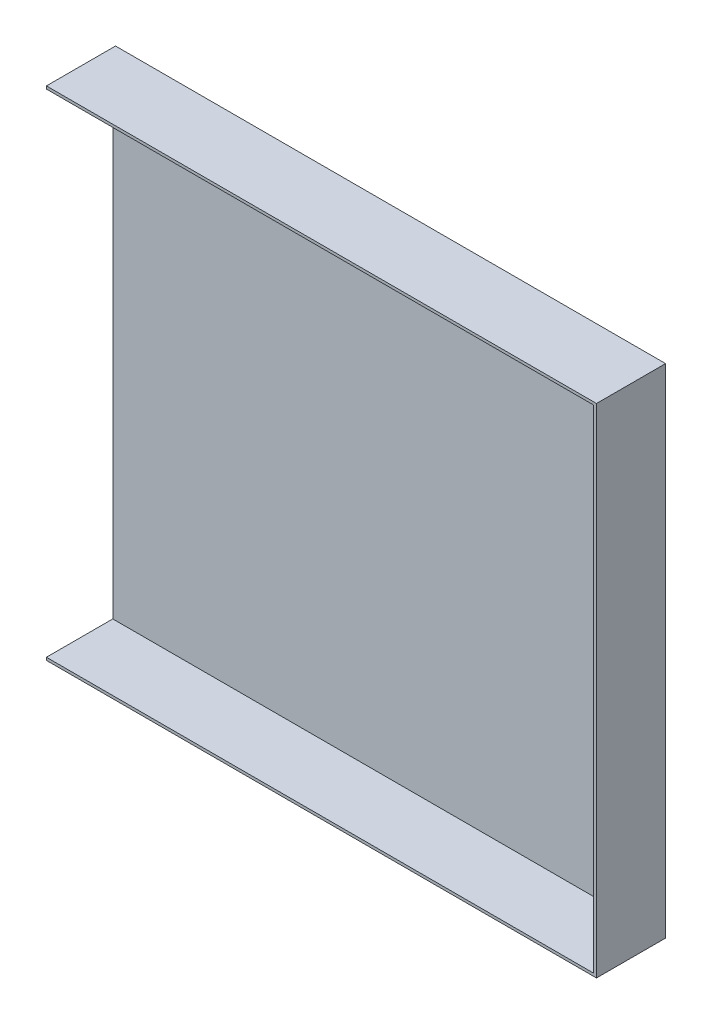
from build123d import *

# Parameters (mm, degrees)
ESQUISSE1_W                  = 400
ESQUISSE1_H                  = 360
BOSS_EXTRU_1_DEPTH           = 50
COQUE1_T                     = -2
ENL_V_MAT_EXTRU_2_DEPTH      = 274.678643668
ENL_V_MAT_EXTRU_2_DEPTH_BACK = 50


with BuildPart() as part:
    # Esquisse1 → Boss.-Extru.1 (new body)
    with BuildSketch(Plane.XY):
        Rectangle(ESQUISSE1_W, ESQUISSE1_H)
    extrude(amount=BOSS_EXTRU_1_DEPTH)

    # Coque1
    coque1_openings = [part.faces().sort_by_distance(p)[0] for p in [
        (0, 0, 50),
    ]]
    offset(amount=COQUE1_T, openings=coque1_openings, kind=Kind.INTERSECTION)

    # Esquisse2 → Enlèv. mat.-Extru.2 (cut, two sides: drawn at the far end of the back side and taken through both)
    with BuildSketch(Plane.XY.offset(50).offset(-ENL_V_MAT_EXTRU_2_DEPTH_BACK)):
        Polygon((909.035446725, -180), (-177.254477041, -180), (-198, -180), (-198, 180), (-200, 180), (-200, -180), (-200, -1266.289923766), (1320.247473242, -2818.369436549), (2429.282919967, -1732.079512783), align=None)
    extrude(amount=ENL_V_MAT_EXTRU_2_DEPTH + ENL_V_MAT_EXTRU_2_DEPTH_BACK, mode=Mode.SUBTRACT)


solid = part.part
